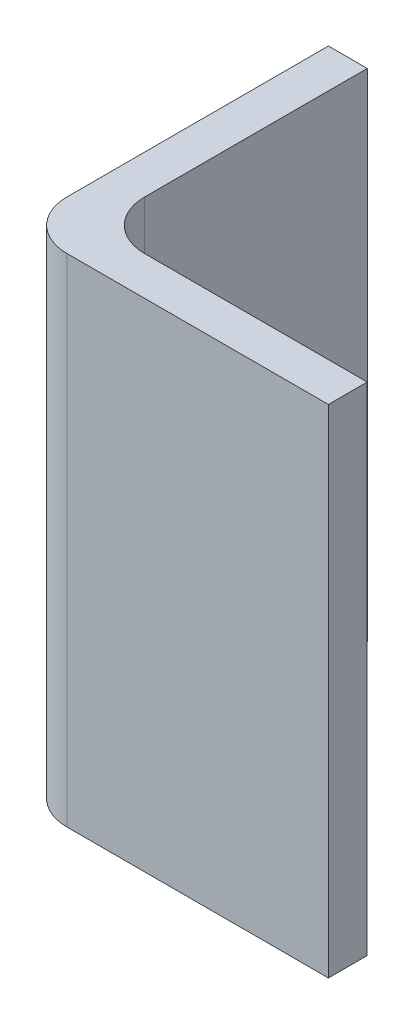
from build123d import *

# Parameters (mm, degrees)
BOSS_EXTRUDE1_DEPTH = 20.32
FILLET1_R           = 2
FILLET2_R           = 2


with BuildPart() as part:
    # Sketch1 → Boss-Extrude1 (new body)
    with BuildSketch(Plane(origin=(0, 0, 0), x_dir=(1, 0, 0), z_dir=(0, 1, 0))):
        Polygon((-7.943330105, 9.7977882), (-6.353330105, 9.7977882), (-6.353330105, -1.3147118), (4.756669895, -1.3147118), (4.756669895, -2.9022118), (-6.353330105, -2.9022118), (-7.943330105, -2.9022118), align=None)
    extrude(amount=BOSS_EXTRUDE1_DEPTH)

    # Fillet1
    fillet1_edges = [part.edges().sort_by_distance(p)[0] for p in [
        (-6.353330105, 10.16, 1.3147118),
    ]]
    fillet(fillet1_edges, radius=FILLET1_R)

    # Fillet2
    fillet2_edges = [part.edges().sort_by_distance(p)[0] for p in [
        (-7.943330105, 10.16, 2.9022118),
    ]]
    fillet(fillet2_edges, radius=FILLET2_R)


solid = part.part
